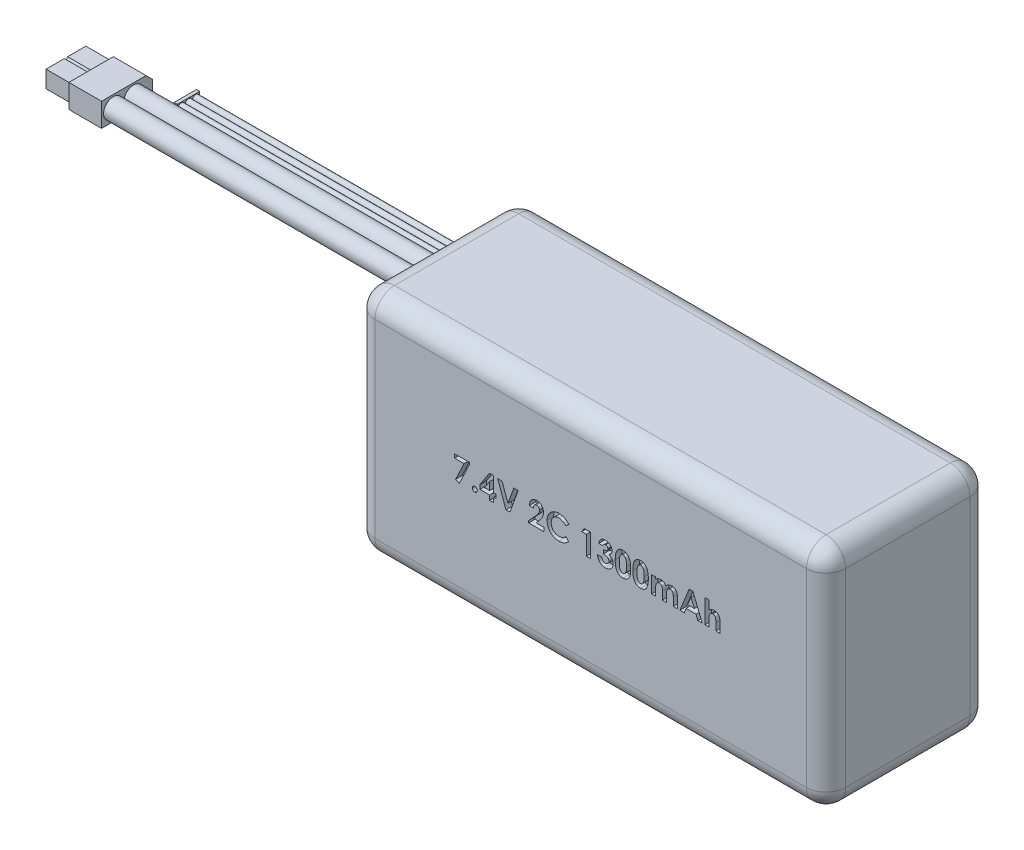
from build123d import *

# Parameters (mm, degrees)
SKETCH_1_W           = 72
SKETCH_1_H           = 35
EXTRUDE_1_DEPTH      = 25
FILLET_2_R           = 3
CUT_EXTRUDE_2_DEPTH  = 1
EXTRUDE_2_DEPTH      = 50
EXTRUDE_2_DEPTH_BACK = 5
SKETCH_3_R           = 1.5
SKETCH_5_W           = 7.8
SKETCH_5_H           = 3.6
EXTRUDE_3_DEPTH      = 5
CHAMFER_1_SIZE       = 1
EXTRUDE_4_DEPTH      = 4
SKETCH_6_R           = 1
CUT_EXTRUDE_3_DEPTH  = 4
EXTRUDE_5_DEPTH      = 40
EXTRUDE_5_DEPTH_BACK = 4
SKETCH_7_R           = 0.5
SKETCH_8_W           = 3.4
SKETCH_8_H           = 1.2
EXTRUDE_6_DEPTH      = 0.5


with BuildPart() as part:
    # ｽｹｯﾁ1 → ﾎﾞｽ - 押し出し1 (new body)
    with BuildSketch(Plane.XY):
        Rectangle(SKETCH_1_W, SKETCH_1_H)
    extrude(amount=EXTRUDE_1_DEPTH)

    # ﾌｨﾚｯﾄ2
    fillet_2_edges = [part.edges().sort_by_distance(p)[0] for p in [
        (36, 0, 25),
        (0, 17.5, 25),
        (-36, 0, 25),
        (0, 17.5, 0),
        (36, 0, 0),
        (0, -17.5, 0),
        (-36, 0, 0),
        (0, -17.5, 25),
        (-36, 17.5, 12.5),
        (36, 17.5, 12.5),
        (36, -17.5, 12.5),
        (-36, -17.5, 12.5),
    ]]
    fillet(fillet_2_edges, radius=FILLET_2_R)

    # ｽｹｯﾁ2 → ｶｯﾄ - 押し出し2 (cut)
    # profile 1 of 13: a face of its own
    with BuildSketch(Plane.XY.offset(25)):
        Polygon((-20.796502723, 2.806037284), (-18.552912979, 2.806037284), (-18.552912979, 2.48001565), (-20.096783171, -0.783706305), (-20.653473877, -0.503257587), (-19.363409774, 2.222703951), (-20.796502723, 2.222703951), align=None)
    # profile 2 of 13: a face of its own
    with BuildSketch(Plane.XY.offset(25)):
        with BuildLine():
            add(Edge.make_bspline(
                [(-17.722784774, 0.023986002), (-17.697424878, 0.02259558), (-17.647495622, 0.019858079), (-17.575354655, -0.000571605), (-17.510247017, -0.037276444), (-17.45203209, -0.085151545), (-17.402807013, -0.142751683), (-17.367228241, -0.208437598), (-17.345072447, -0.280300596), (-17.342626431, -0.330386935), (-17.341374518, -0.35602201)],
                knots=[0, 0, 0, 0, 1.016957001, 2.002212695, 2.9757545, 3.99499976, 5.013036768, 5.994806404, 6.97370641, 8, 8, 8, 8], degree=3))
            add(Edge.make_bspline(
                [(-17.341374518, -0.35602201), (-17.34261823, -0.381661203), (-17.345048222, -0.431755586), (-17.367381557, -0.503758614), (-17.402753847, -0.569984407), (-17.452036039, -0.628201769), (-17.510005929, -0.676979121), (-17.575504349, -0.713345487), (-17.647358195, -0.734934096), (-17.697400689, -0.737521864), (-17.722784774, -0.73883451)],
                knots=[0, 0, 0, 0, 1.023218912, 1.999186227, 2.986238111, 4.008388923, 5.030539734, 6.0011649, 6.986089706, 8, 8, 8, 8], degree=3))
            add(Edge.make_bspline(
                [(-17.722784774, -0.73883451), (-17.748174874, -0.737532538), (-17.798229225, -0.734965813), (-17.870194763, -0.713163516), (-17.936176743, -0.677221916), (-17.994161198, -0.628142602), (-18.043663561, -0.57019056), (-18.078030185, -0.50354966), (-18.100571548, -0.431782732), (-18.10296832, -0.381670393), (-18.10419503, -0.35602201)],
                knots=[0, 0, 0, 0, 1.013427518, 1.99788335, 2.976245624, 3.997909735, 5.019573847, 6.001765691, 6.977268297, 8, 8, 8, 8], degree=3))
            add(Edge.make_bspline(
                [(-18.10419503, -0.35602201), (-18.102960227, -0.330377585), (-18.100547643, -0.280272977), (-18.078183064, -0.208648959), (-18.043608483, -0.14254441), (-17.994165326, -0.085210835), (-17.935934413, -0.037035544), (-17.870345297, -0.000751083), (-17.798091867, 0.01989003), (-17.748150714, 0.022606342), (-17.722784774, 0.023986002)],
                knots=[0, 0, 0, 0, 1.025808215, 2.00424526, 2.981110158, 3.998665696, 5.017428914, 5.998734231, 6.983523959, 8, 8, 8, 8], degree=3))
        make_face()
    # profile 3 of 13: a face of its own
    with BuildSketch(Plane.XY.offset(25)):
        Polygon((-15.483401761, 2.895780874), (-14.828554005, 2.895780874), (-14.828554005, 0.607319336), (-14.514451441, 0.607319336), (-14.514451441, 0.023986002), (-14.828554005, 0.023986002), (-14.828554005, -0.693962716), (-15.456759133, -0.693962716), (-15.456759133, 0.023986002), (-16.937528364, 0.023986002), (-16.937528364, 0.65990347), align=None)
        Polygon((-15.456759133, 0.607319336), (-15.456759133, 1.798525265), (-16.231498716, 0.607319336), align=None, mode=Mode.SUBTRACT)
    # profile 4 of 13: a face of its own
    with BuildSketch(Plane.XY.offset(25)):
        Polygon((-14.222784774, 2.806037284), (-13.551811216, 2.806037284), (-12.652271954, 0.3198594), (-11.750629325, 2.806037284), (-11.081759133, 2.806037284), (-12.350789582, -0.693962716), (-12.955857691, -0.693962716), align=None)
    # profile 5 of 13: a face of its own
    with BuildSketch(Plane.XY.offset(25)):
        with BuildLine():
            Line((-8.770861697, 1.639370618), (-9.399066825, 1.639370618))
            add(Edge.make_bspline(
                [(-9.399066825, 1.639370618), (-9.396353704, 1.686891012), (-9.391052427, 1.77974301), (-9.369965288, 1.91461351), (-9.341709246, 2.042051301), (-9.303997806, 2.161610593), (-9.256610915, 2.273247941), (-9.200767958, 2.377343922), (-9.135042276, 2.473350471), (-9.060832727, 2.560804588), (-8.979399185, 2.639260483), (-8.89243229, 2.708824409), (-8.798601767, 2.76622681), (-8.699621976, 2.813463671), (-8.59550977, 2.851203729), (-8.485280086, 2.876436011), (-8.369887351, 2.89352356), (-8.29089168, 2.895018789), (-8.250629325, 2.895780874)],
                knots=[0, 0, 0, 0, 1.199038563, 2.342849363, 3.436047546, 4.486744587, 5.497670872, 6.488682221, 7.459191391, 8.424610317, 9.374430501, 10.305433194, 11.225809216, 12.140057399, 13.06607119, 14.010487599, 14.985989317, 16, 16, 16, 16], degree=3))
            add(Edge.make_bspline(
                [(-8.250629325, 2.895780874), (-8.201207856, 2.894238794), (-8.104725565, 2.891228292), (-7.964529145, 2.865547713), (-7.833601016, 2.822592975), (-7.712036353, 2.762573878), (-7.600870055, 2.686325907), (-7.500120559, 2.595412681), (-7.412834688, 2.487926791), (-7.338459025, 2.368340552), (-7.276661738, 2.241715555), (-7.233356774, 2.110780056), (-7.204892887, 1.979008555), (-7.201857037, 1.890280295), (-7.200348877, 1.846201547)],
                knots=[0, 0, 0, 0, 1.075374347, 2.099382735, 3.09057751, 4.06680945, 5.040638231, 6.016817125, 7.011024321, 8.044445721, 9.0776792, 10.070479129, 11.0414456, 12, 12, 12, 12], degree=3))
            add(Edge.make_bspline(
                [(-7.200348877, 1.846201547), (-7.200936075, 1.819539605), (-7.202117959, 1.765875702), (-7.21033576, 1.684669045), (-7.222664085, 1.601950571), (-7.241252195, 1.517791203), (-7.264433091, 1.43216735), (-7.292554869, 1.344822768), (-7.326269841, 1.256252671), (-7.365015373, 1.165460216), (-7.41123889, 1.072150636), (-7.465059751, 0.974925183), (-7.527906482, 0.873870106), (-7.599019976, 0.768414813), (-7.678745612, 0.658725624), (-7.767472586, 0.545132958), (-7.864178971, 0.427236549), (-7.932814213, 0.348429416), (-7.968077242, 0.307940329)],
                knots=[0, 0, 0, 0, 0.728284026, 1.46585585, 2.227944881, 3.01186502, 3.81876927, 4.650621989, 5.517437689, 6.406905708, 7.346299482, 8.360816762, 9.441613733, 10.596154504, 11.834900912, 13.145207542, 14.533280747, 16, 16, 16, 16], degree=3))
            Line((-7.968077242, 0.307940329), (-8.333361697, -0.110629382))
            Line((-8.333361697, -0.110629382), (-7.155477082, -0.110629382))
            Line((-7.155477082, -0.110629382), (-7.155477082, -0.693962716))
            Line((-7.155477082, -0.693962716), (-9.488810415, -0.693962716))
            Line((-9.488810415, -0.693962716), (-9.488810415, -0.375653421))
            Line((-9.488810415, -0.375653421), (-8.452552402, 0.727211163))
            add(Edge.make_bspline(
                [(-8.452552402, 0.727211163), (-8.42255007, 0.759382065), (-8.364444449, 0.821687562), (-8.281766139, 0.913189814), (-8.206949572, 1.000023267), (-8.14154613, 1.083112521), (-8.082123525, 1.159762501), (-8.031331406, 1.232283531), (-7.988705065, 1.300019996), (-7.942428126, 1.381698343), (-7.898480246, 1.479114306), (-7.858155406, 1.59134149), (-7.833574626, 1.698604831), (-7.830181701, 1.76849993), (-7.828554005, 1.802030874)],
                knots=[0, 0, 0, 0, 1.246127091, 2.413378631, 3.493388633, 4.492180848, 5.408488754, 6.240484944, 6.999099869, 7.674939598, 8.898438119, 10.020720584, 11.050475521, 12, 12, 12, 12], degree=3))
            add(Edge.make_bspline(
                [(-7.828554005, 1.802030874), (-7.829770994, 1.834469476), (-7.832129105, 1.897324467), (-7.858042839, 1.986735357), (-7.898189293, 2.067687791), (-7.954761317, 2.137762818), (-8.023287756, 2.195348115), (-8.102476494, 2.238178441), (-8.191681909, 2.262891343), (-8.254216604, 2.265984515), (-8.286386537, 2.267575746)],
                knots=[0, 0, 0, 0, 1.062038974, 2.057870785, 3.028805853, 4.01125022, 4.991535629, 5.949134679, 6.94496649, 8, 8, 8, 8], degree=3))
            add(Edge.make_bspline(
                [(-8.286386537, 2.267575746), (-8.303005934, 2.266987926), (-8.335723886, 2.265830708), (-8.383816718, 2.258127423), (-8.429580502, 2.244551188), (-8.473524616, 2.226360943), (-8.515180077, 2.202249642), (-8.554441815, 2.172528623), (-8.591723502, 2.137953164), (-8.626854151, 2.098631377), (-8.658827628, 2.054748251), (-8.687226353, 2.00670457), (-8.710707371, 1.954530154), (-8.731380913, 1.898913787), (-8.747325337, 1.839258102), (-8.758934856, 1.775920132), (-8.767760798, 1.709002921), (-8.769809261, 1.66300363), (-8.770861697, 1.639370618)],
                knots=[0, 0, 0, 0, 0.903469896, 1.778625579, 2.63899355, 3.493148037, 4.358286772, 5.247621495, 6.164656832, 7.118446693, 8.109501108, 9.111810964, 10.146451449, 11.215617525, 12.33435995, 13.498009769, 14.714554818, 16, 16, 16, 16], degree=3))
        make_face()
    # profile 6 of 13: a face of its own
    with BuildSketch(Plane.XY.offset(25)):
        with BuildLine():
            Line((-3.341374518, 2.19886581), (-3.802011537, 1.758561323))
            add(Edge.make_bspline(
                [(-3.802011537, 1.758561323), (-3.841086522, 1.798964923), (-3.917412208, 1.877885811), (-4.040401613, 1.982370112), (-4.168306116, 2.069443639), (-4.298637591, 2.14277641), (-4.433740322, 2.198257877), (-4.572052154, 2.238688157), (-4.714456249, 2.26333697), (-4.810829864, 2.266157231), (-4.859303204, 2.267575746)],
                knots=[0, 0, 0, 0, 1.115251505, 2.178435587, 3.19620269, 4.182487026, 5.141301733, 6.088180966, 7.038406374, 8, 8, 8, 8], degree=3))
            add(Edge.make_bspline(
                [(-4.859303204, 2.267575746), (-4.899784333, 2.266455069), (-4.979669381, 2.264243537), (-5.096961566, 2.248030827), (-5.209157603, 2.220460408), (-5.316641556, 2.182463263), (-5.41909715, 2.133296975), (-5.516739195, 2.072999596), (-5.609326958, 2.002115697), (-5.69563741, 1.921012036), (-5.774591179, 1.832400192), (-5.84435186, 1.737851565), (-5.902787621, 1.637582762), (-5.950744899, 1.532609231), (-5.988101766, 1.422445103), (-6.014779261, 1.307164544), (-6.030208812, 1.186630264), (-6.032511776, 1.104691959), (-6.03368221, 1.063048502)],
                knots=[0, 0, 0, 0, 1.035432265, 2.043311493, 3.022114605, 3.98653278, 4.95457646, 5.923598177, 6.917315552, 7.932509744, 8.948865224, 9.949768934, 10.933144597, 11.912367597, 12.897413939, 13.903909035, 14.934704909, 16, 16, 16, 16], degree=3))
            add(Edge.make_bspline(
                [(-6.03368221, 1.063048502), (-6.033344904, 1.033820211), (-6.032680068, 0.976210647), (-6.025402256, 0.890990113), (-6.013683264, 0.808306048), (-5.996722979, 0.728283696), (-5.975513975, 0.65085371), (-5.950630985, 0.575348104), (-5.919415639, 0.502810196), (-5.884766135, 0.432397506), (-5.84446916, 0.366031331), (-5.801021588, 0.302745676), (-5.75390979, 0.24285076), (-5.702828619, 0.186591435), (-5.647059172, 0.134846909), (-5.588042883, 0.086061162), (-5.524784229, 0.041455467), (-5.458597251, -8.9606e-05), (-5.388910179, -0.036180164), (-5.317613785, -0.068871237), (-5.24362707, -0.095421249), (-5.167850868, -0.11682298), (-5.090555976, -0.135021957), (-5.010986379, -0.146227626), (-4.929831845, -0.154713548), (-4.874985002, -0.155237504), (-4.847384133, -0.155501177)],
                knots=[0, 0, 0, 0, 1.103660481, 2.175337485, 3.227646561, 4.255952547, 5.262355991, 6.258840057, 7.255597736, 8.242457506, 9.22035537, 10.185017736, 11.140346927, 12.096287581, 13.051739095, 14.01125915, 14.986044842, 15.97314143, 16.960198552, 17.947847494, 18.933482797, 19.925264591, 20.920966487, 21.929612487, 22.958107872, 24, 24, 24, 24], degree=3))
            add(Edge.make_bspline(
                [(-4.847384133, -0.155501177), (-4.800568316, -0.154147015), (-4.70858741, -0.151486439), (-4.573592204, -0.130681112), (-4.444955222, -0.096457527), (-4.342174889, -0.056041461), (-4.261649212, -0.016130071), (-4.200346205, 0.020785999), (-4.136954118, 0.062080677), (-4.072525839, 0.109312468), (-4.006336678, 0.161914572), (-3.939555026, 0.221039073), (-3.870471261, 0.284739086), (-3.825215172, 0.330203037), (-3.802011537, 0.353513246)],
                knots=[0, 0, 0, 0, 1.404581149, 2.759636711, 4.088442092, 5.392261763, 6.066678138, 6.783632037, 7.538459478, 8.336747902, 9.180226004, 10.074962426, 11.012997595, 12, 12, 12, 12], degree=3))
            Line((-3.802011537, 0.353513246), (-3.355396954, -0.115537235))
            add(Edge.make_bspline(
                [(-3.355396954, -0.115537235), (-3.386791555, -0.145847737), (-3.448067103, -0.205007354), (-3.540499565, -0.289008491), (-3.632815698, -0.36449285), (-3.722785335, -0.434200184), (-3.811882274, -0.496099747), (-3.900097065, -0.550253361), (-3.986431079, -0.598030647), (-4.072677068, -0.638625867), (-4.159371701, -0.673095424), (-4.24857029, -0.702771451), (-4.340545524, -0.727876302), (-4.435859146, -0.748132619), (-4.533622127, -0.764375451), (-4.634749401, -0.775339269), (-4.738599769, -0.782709879), (-4.809043083, -0.783372189), (-4.844579646, -0.783706305)],
                knots=[0, 0, 0, 0, 1.244526981, 2.429050516, 3.560637417, 4.644440555, 5.67424972, 6.652764056, 7.595344123, 8.486817594, 9.369275933, 10.254498637, 11.166417451, 12.086725134, 13.032340136, 13.991389299, 14.986715468, 16, 16, 16, 16], degree=3))
            add(Edge.make_bspline(
                [(-4.844579646, -0.783706305), (-4.90985591, -0.782042283), (-5.037583414, -0.778786254), (-5.22476474, -0.754661285), (-5.402581976, -0.7142162), (-5.571467717, -0.657015694), (-5.731368261, -0.583944728), (-5.882242701, -0.494363155), (-6.023847862, -0.388508978), (-6.155039851, -0.267622913), (-6.273709249, -0.134114401), (-6.378599254, 0.009237113), (-6.46536427, 0.16313615), (-6.537407132, 0.325309131), (-6.593743703, 0.496496112), (-6.633395099, 0.676882267), (-6.657847825, 0.866293421), (-6.660522988, 0.995665605), (-6.661887338, 1.061646259)],
                knots=[0, 0, 0, 0, 1.078019885, 2.10938526, 3.111377082, 4.085535484, 5.04941344, 6.010039228, 6.978205633, 7.964457913, 8.951525778, 9.924444315, 10.892603023, 11.863865945, 12.85144698, 13.863884204, 14.910567087, 16, 16, 16, 16], degree=3))
            add(Edge.make_bspline(
                [(-6.661887338, 1.061646259), (-6.66131083, 1.104678278), (-6.660168331, 1.189957223), (-6.648160564, 1.315580017), (-6.631421038, 1.438039771), (-6.604865302, 1.556064947), (-6.572854982, 1.671245561), (-6.533045943, 1.782329735), (-6.485501766, 1.889636736), (-6.431754911, 1.993346202), (-6.370951632, 2.092778724), (-6.303027695, 2.187080022), (-6.229731726, 2.276978083), (-6.149302543, 2.361280243), (-6.062908887, 2.440726692), (-5.970160701, 2.514886893), (-5.871615818, 2.584824387), (-5.767007515, 2.648735658), (-5.658368052, 2.706546799), (-5.547067658, 2.757538694), (-5.433379786, 2.800156176), (-5.317785118, 2.835505805), (-5.199795268, 2.861891804), (-5.080252418, 2.881865154), (-4.958139402, 2.893030384), (-4.87615109, 2.894858203), (-4.834763941, 2.895780874)],
                knots=[0, 0, 0, 0, 1.071919942, 2.124283339, 3.142214191, 4.149696895, 5.136002878, 6.119640489, 7.086990633, 8.058538607, 9.028339693, 9.988281803, 10.952401235, 11.916291999, 12.888973767, 13.874849856, 14.873389453, 15.898127285, 16.927174885, 17.938320013, 18.946391617, 19.950418109, 20.947802303, 21.956882652, 22.968648068, 24, 24, 24, 24], degree=3))
            add(Edge.make_bspline(
                [(-4.834763941, 2.895780874), (-4.799456458, 2.895251976), (-4.729208594, 2.894199679), (-4.624597735, 2.885427639), (-4.520823504, 2.871651238), (-4.418257446, 2.850865583), (-4.316165903, 2.826190383), (-4.215890472, 2.793881614), (-4.115849255, 2.757867401), (-4.017611248, 2.714819764), (-3.921039326, 2.667829379), (-3.828395839, 2.614517081), (-3.738125311, 2.558163649), (-3.652228083, 2.495433841), (-3.569095114, 2.428602982), (-3.489161115, 2.357359269), (-3.413127552, 2.280514861), (-3.365413109, 2.22621975), (-3.341374518, 2.19886581)],
                knots=[0, 0, 0, 0, 0.996412454, 1.982464992, 2.961075852, 3.949442424, 4.934965278, 5.923860011, 6.921385422, 7.934793307, 8.949617135, 9.951082467, 10.950285876, 11.951772932, 12.951063433, 13.960125323, 14.972308753, 16, 16, 16, 16], degree=3))
        make_face()
    # profile 7 of 13: a face of its own
    with BuildSketch(Plane.XY.offset(25)):
        Polygon((-0.991915383, 2.806037284), (-0.020861697, 2.806037284), (-0.020861697, -0.693962716), (-0.649066825, -0.693962716), (-0.649066825, 2.222703951), (-1.367015543, 2.222703951), align=None)
    # profile 8 of 13: a face of its own
    with BuildSketch(Plane.XY.offset(25)):
        with BuildLine():
            Line((1.863753688, 1.953473182), (1.235548559, 1.953473182))
            add(Edge.make_bspline(
                [(1.235548559, 1.953473182), (1.239983926, 1.984874915), (1.24867917, 2.046435933), (1.269485725, 2.135560951), (1.294372609, 2.220102131), (1.325442613, 2.299791747), (1.361882673, 2.374771752), (1.403322234, 2.445299443), (1.450209274, 2.5110721), (1.486148687, 2.55069381), (1.504078207, 2.570460361)],
                knots=[0, 0, 0, 0, 1.111473889, 2.178970933, 3.205615836, 4.199322666, 5.174200091, 6.12565194, 7.064921805, 8, 8, 8, 8], degree=3))
            add(Edge.make_bspline(
                [(1.504078207, 2.570460361), (1.529939164, 2.596540893), (1.580908392, 2.647942881), (1.66608395, 2.713783149), (1.755363665, 2.770763424), (1.85053808, 2.815937798), (1.950126211, 2.85250122), (2.054920015, 2.877060954), (2.164491269, 2.893356554), (2.239259865, 2.894961727), (2.277415546, 2.895780874)],
                knots=[0, 0, 0, 0, 1.01925491, 2.00884431, 2.983262333, 3.955970413, 4.92937149, 5.924503185, 6.940838805, 8, 8, 8, 8], degree=3))
            add(Edge.make_bspline(
                [(2.277415546, 2.895780874), (2.311337911, 2.894980034), (2.378022443, 2.893405742), (2.476031927, 2.880768188), (2.569475767, 2.858603323), (2.659341694, 2.829623261), (2.744308071, 2.790191042), (2.826250188, 2.74441863), (2.902878581, 2.688276864), (2.974372546, 2.624842318), (3.040053388, 2.556231646), (3.096933284, 2.482892481), (3.145833952, 2.40678388), (3.186121635, 2.327273525), (3.217097387, 2.244226875), (3.238595479, 2.158123678), (3.252666501, 2.069153929), (3.254068343, 2.008682388), (3.254779329, 1.978012445)],
                knots=[0, 0, 0, 0, 1.091422571, 2.145516843, 3.172569842, 4.178562979, 5.178154469, 6.181868002, 7.194278174, 8.227918432, 9.254613415, 10.245994977, 11.209837596, 12.161663635, 13.10878368, 14.055455738, 15.013766427, 16, 16, 16, 16], degree=3))
            add(Edge.make_bspline(
                [(3.254779329, 1.978012445), (3.253320343, 1.940030273), (3.25044805, 1.865255055), (3.226878805, 1.755815968), (3.189986527, 1.65117267), (3.136692043, 1.552789279), (3.070060364, 1.460933539), (2.988305525, 1.378676464), (2.893756117, 1.304728373), (2.822776617, 1.26498866), (2.78642997, 1.244639047)],
                knots=[0, 0, 0, 0, 0.992805628, 1.954529043, 2.915727527, 3.886831945, 4.871318353, 5.87440735, 6.911542536, 8, 8, 8, 8], degree=3))
            add(Edge.make_bspline(
                [(2.78642997, 1.244639047), (2.811377751, 1.236448165), (2.860399022, 1.22035345), (2.930076865, 1.18865509), (2.996332531, 1.154014037), (3.058025123, 1.113770264), (3.115768247, 1.069551053), (3.169209894, 1.0209784), (3.218669366, 0.968158218), (3.263339258, 0.910800015), (3.302985532, 0.849821123), (3.338558022, 0.78663012), (3.367836165, 0.720268702), (3.392638397, 0.651494761), (3.411521404, 0.579690194), (3.424816729, 0.505133237), (3.432501752, 0.427993959), (3.43367385, 0.375732146), (3.434266508, 0.349306515)],
                knots=[0, 0, 0, 0, 1.059543567, 2.081955587, 3.086750234, 4.076226789, 5.052108497, 6.020845489, 6.989030705, 7.970690546, 8.952259656, 9.923888338, 10.895517021, 11.877585046, 12.873342345, 13.889638361, 14.932918083, 16, 16, 16, 16], degree=3))
            add(Edge.make_bspline(
                [(3.434266508, 0.349306515), (3.43306511, 0.310471568), (3.430696197, 0.233896961), (3.415635757, 0.121110401), (3.387595932, 0.013578436), (3.350707989, -0.08993625), (3.301503476, -0.188097321), (3.243598036, -0.28315744), (3.172420617, -0.371819948), (3.093319137, -0.456428851), (3.005472332, -0.533351478), (2.910232104, -0.600039934), (2.809692704, -0.657270494), (2.703218047, -0.703731894), (2.590845127, -0.739512485), (2.472824411, -0.765376346), (2.348660009, -0.781200284), (2.26390809, -0.782859124), (2.220624681, -0.783706305)],
                knots=[0, 0, 0, 0, 1.005138573, 1.981928558, 2.936866704, 3.876260664, 4.820238198, 5.773547, 6.751179199, 7.756627054, 8.768222608, 9.766606018, 10.760583154, 11.757261445, 12.767156078, 13.807575856, 14.880313354, 16, 16, 16, 16], degree=3))
            add(Edge.make_bspline(
                [(2.220624681, -0.783706305), (2.179679274, -0.782813096), (2.099615949, -0.781066543), (1.982506579, -0.765949242), (1.871205208, -0.741563808), (1.765427793, -0.707190517), (1.665583578, -0.662614233), (1.570767138, -0.609533881), (1.482870513, -0.544887909), (1.400914362, -0.471594559), (1.32671672, -0.389363582), (1.260401501, -0.300099817), (1.203430968, -0.203463831), (1.155571482, -0.099868494), (1.117197199, 0.010867933), (1.086927677, 0.12852026), (1.06578392, 0.253318345), (1.059344544, 0.339182082), (1.05606138, 0.382960361)],
                knots=[0, 0, 0, 0, 1.066544725, 2.085487077, 3.070979577, 4.031932826, 4.977951092, 5.916076795, 6.857635327, 7.814973522, 8.776389752, 9.738577119, 10.707772778, 11.69409279, 12.707140348, 13.757286496, 14.856535458, 16, 16, 16, 16], degree=3))
            Line((1.05606138, 0.382960361), (1.684266508, 0.382960361))
            add(Edge.make_bspline(
                [(1.684266508, 0.382960361), (1.688247378, 0.360948068), (1.696001167, 0.318073353), (1.711124457, 0.256000298), (1.730832214, 0.198703034), (1.753619284, 0.145672304), (1.778232751, 0.096211835), (1.807971704, 0.052148323), (1.84065703, 0.012285263), (1.887822194, -0.035104382), (1.955248044, -0.083795264), (2.046295279, -0.126109956), (2.147576706, -0.150911565), (2.218382525, -0.153937285), (2.254979649, -0.155501177)],
                knots=[0, 0, 0, 0, 0.928156231, 1.807827665, 2.648129825, 3.438902246, 4.202261636, 4.936546065, 5.639352463, 6.338805438, 7.70633318, 9.064371875, 10.482673459, 12, 12, 12, 12], degree=3))
            add(Edge.make_bspline(
                [(2.254979649, -0.155501177), (2.274399377, -0.155168161), (2.312438279, -0.154515857), (2.368311762, -0.147285941), (2.421539122, -0.135378263), (2.472219498, -0.119196171), (2.520675522, -0.098910906), (2.565981396, -0.072754271), (2.609060566, -0.042343449), (2.649444721, -0.008153612), (2.686760513, 0.029101072), (2.717809447, 0.070354305), (2.746185925, 0.112274962), (2.767173373, 0.157605642), (2.785562899, 0.203907069), (2.796818228, 0.252859841), (2.80531681, 0.303437058), (2.805810714, 0.338049886), (2.80606138, 0.355616611)],
                knots=[0, 0, 0, 0, 1.110435564, 2.175094844, 3.216326037, 4.226890168, 5.215276772, 6.21526065, 7.213097102, 8.228249917, 9.239874822, 10.221364777, 11.178138315, 12.128914389, 13.072518965, 14.022636769, 14.996447288, 16, 16, 16, 16], degree=3))
            add(Edge.make_bspline(
                [(2.80606138, 0.355616611), (2.805395908, 0.374828819), (2.804071106, 0.413075921), (2.793247334, 0.468889524), (2.776154311, 0.522577712), (2.752410015, 0.573902729), (2.720702153, 0.6226754), (2.683287229, 0.669874252), (2.637217567, 0.713042671), (2.586672978, 0.755713344), (2.528061111, 0.792909302), (2.464236446, 0.827235705), (2.393521572, 0.854548925), (2.317642703, 0.878944689), (2.235164518, 0.896762977), (2.146599177, 0.90970079), (2.052089548, 0.919330987), (1.986942833, 0.920712597), (1.953497277, 0.9214219)],
                knots=[0, 0, 0, 0, 0.809814727, 1.612155564, 2.388397, 3.182215007, 3.988903953, 4.837162975, 5.715530372, 6.646997145, 7.623086902, 8.637258368, 9.698941581, 10.815059213, 11.996518529, 13.252603015, 14.589518788, 16, 16, 16, 16], degree=3))
            Line((1.953497277, 0.9214219), (1.953497277, 1.504755233))
            add(Edge.make_bspline(
                [(1.953497277, 1.504755233), (1.995138983, 1.508301574), (2.073042367, 1.514936076), (2.181176442, 1.530451088), (2.272211394, 1.551189456), (2.34833525, 1.576209175), (2.411543622, 1.608341013), (2.466762107, 1.643813143), (2.514318878, 1.685008838), (2.554510729, 1.730699647), (2.58666296, 1.779767292), (2.609418435, 1.831449116), (2.624444962, 1.884146019), (2.625868725, 1.920189112), (2.6265742, 1.938048502)],
                knots=[0, 0, 0, 0, 1.70044513, 3.18119609, 4.440695891, 5.496282586, 6.431922213, 7.318171381, 8.16090191, 8.983045123, 9.787564368, 10.536848927, 11.275007137, 12, 12, 12, 12], degree=3))
            add(Edge.make_bspline(
                [(2.6265742, 1.938048502), (2.625357053, 1.960835145), (2.622981439, 2.005309846), (2.604531131, 2.068962514), (2.572503489, 2.125703591), (2.529560043, 2.175413678), (2.477231962, 2.216935269), (2.415894278, 2.247079236), (2.346878022, 2.264790163), (2.298321367, 2.266626189), (2.273208816, 2.267575746)],
                knots=[0, 0, 0, 0, 1.009664648, 1.970651636, 2.907870547, 3.878035693, 4.867062054, 5.849714035, 6.887914197, 8, 8, 8, 8], degree=3))
            add(Edge.make_bspline(
                [(2.273208816, 2.267575746), (2.250447111, 2.266455369), (2.205280919, 2.264232197), (2.139234426, 2.247639033), (2.076512263, 2.219706507), (2.018413227, 2.181189199), (1.965775991, 2.134931544), (1.922576006, 2.080148955), (1.886644308, 2.020123549), (1.871413807, 1.975777067), (1.863753688, 1.953473182)],
                knots=[0, 0, 0, 0, 0.98818071, 1.960853194, 2.938124878, 3.957524365, 4.978590984, 5.968022688, 6.978025184, 8, 8, 8, 8], degree=3))
        make_face()
    # profile 9 of 13: a face of its own
    with BuildSketch(Plane.XY.offset(25)):
        with BuildLine():
            add(Edge.make_bspline(
                [(4.926954809, 2.895780874), (4.957362545, 2.895329463), (5.017152277, 2.894441867), (5.105211299, 2.884828486), (5.190036483, 2.870305348), (5.271959677, 2.850050634), (5.35039119, 2.823244242), (5.425901861, 2.79115745), (5.497592895, 2.75210724), (5.566378583, 2.707998022), (5.632232428, 2.658060135), (5.693571679, 2.601128365), (5.75151652, 2.538512715), (5.80481266, 2.469266548), (5.854640357, 2.394019731), (5.900835887, 2.312760334), (5.943045611, 2.225090645), (5.981742599, 2.130852458), (6.016345567, 2.028633183), (6.045491605, 1.917260321), (6.07048921, 1.796708437), (6.091588952, 1.66667746), (6.107536946, 1.526994548), (6.118286216, 1.377752499), (6.125662873, 1.219239029), (6.126264904, 1.110500091), (6.1265742, 1.054635041)],
                knots=[0, 0, 0, 0, 0.879237366, 1.728815576, 2.559023295, 3.367336655, 4.166867292, 4.954216142, 5.737608147, 6.525189134, 7.316157332, 8.124696809, 8.942788509, 9.781158001, 10.649253743, 11.551476218, 12.482711956, 13.461909668, 14.496590415, 15.601789533, 16.789733467, 18.056700938, 19.410929216, 20.8549011, 22.384193279, 24, 24, 24, 24], degree=3))
            add(Edge.make_bspline(
                [(6.1265742, 1.054635041), (6.126239935, 0.998071056), (6.125590463, 0.888168249), (6.118592865, 0.728204935), (6.106542671, 0.577879298), (6.09101151, 0.437206892), (6.069738069, 0.306262004), (6.044823912, 0.184705573), (6.015217813, 0.072581662), (5.979475033, -0.029857091), (5.941012279, -0.124260781), (5.898687094, -0.211759534), (5.853237199, -0.292590347), (5.805705079, -0.367972661), (5.753484848, -0.435684244), (5.699118211, -0.498027645), (5.640237948, -0.552628122), (5.579323147, -0.60229954), (5.51414225, -0.645225614), (5.445367453, -0.68276805), (5.371772619, -0.713219425), (5.294699257, -0.739704404), (5.212833636, -0.758717761), (5.127476589, -0.773804235), (5.037664454, -0.782141946), (4.976516735, -0.783176294), (4.945183976, -0.783706305)],
                knots=[0, 0, 0, 0, 1.643780988, 3.193836972, 4.651895693, 6.025988579, 7.305620092, 8.505800249, 9.631074763, 10.672816429, 11.65661981, 12.592235626, 13.49536222, 14.350718032, 15.179365177, 15.97804903, 16.751647189, 17.51006938, 18.259804725, 19.016521909, 19.783502495, 20.571750527, 21.382245291, 22.22305063, 23.089471752, 24, 24, 24, 24], degree=3))
            add(Edge.make_bspline(
                [(4.945183976, -0.783706305), (4.913852063, -0.783166071), (4.852473306, -0.782107759), (4.76241831, -0.77386623), (4.676608914, -0.758656645), (4.594095605, -0.739558433), (4.515452661, -0.713278025), (4.440302993, -0.681915567), (4.369224436, -0.644607377), (4.302020185, -0.60158129), (4.238919694, -0.552242211), (4.178942383, -0.497117878), (4.122220924, -0.436348015), (4.069618191, -0.36925195), (4.020272705, -0.296725277), (3.974699059, -0.217939775), (3.932924644, -0.133010154), (3.893642747, -0.041818032), (3.859511751, 0.057599855), (3.829136749, 0.166131294), (3.804254346, 0.284680984), (3.784242253, 0.413210842), (3.768264609, 0.551448569), (3.756379079, 0.699460891), (3.749342612, 0.857316746), (3.748699952, 0.965818939), (3.748369072, 1.021682316)],
                knots=[0, 0, 0, 0, 0.917216111, 1.796812873, 2.643793957, 3.46689424, 4.273913431, 5.068098542, 5.848489301, 6.620921603, 7.401012384, 8.190319798, 9.003608147, 9.831726257, 10.68377682, 11.569763213, 12.493818149, 13.453288342, 14.474581811, 15.568529029, 16.750744269, 18.018426408, 19.375425659, 20.823733699, 22.36466933, 24, 24, 24, 24], degree=3))
            add(Edge.make_bspline(
                [(3.748369072, 1.021682316), (3.74896843, 1.099300082), (3.750124899, 1.24906456), (3.764780519, 1.465430686), (3.786291253, 1.665423691), (3.817885425, 1.848709033), (3.856951182, 2.015965549), (3.906976918, 2.166091441), (3.963927579, 2.301164036), (4.012456859, 2.381181855), (4.035829008, 2.419719175)],
                knots=[0, 0, 0, 0, 1.288568992, 2.486310467, 3.599230591, 4.627010532, 5.572937695, 6.447898582, 7.252493626, 8, 8, 8, 8], degree=3))
            add(Edge.make_bspline(
                [(4.035829008, 2.419719175), (4.06300503, 2.457578227), (4.116139508, 2.531600133), (4.209046628, 2.628777058), (4.308863232, 2.711887524), (4.417639496, 2.779050665), (4.533655078, 2.832015523), (4.657906032, 2.869424006), (4.789933518, 2.891219931), (4.880598996, 2.894237857), (4.926954809, 2.895780874)],
                knots=[0, 0, 0, 0, 1.058512271, 2.069600068, 3.047294572, 4.004278952, 4.967380941, 5.939006123, 6.946246673, 8, 8, 8, 8], degree=3))
        make_face()
        with BuildLine():
            add(Edge.make_bspline(
                [(4.942379489, 2.267575746), (4.914890644, 2.266272829), (4.860997915, 2.263718421), (4.782796999, 2.2420351), (4.709058417, 2.20854404), (4.652967447, 2.168242787), (4.610983914, 2.129609203), (4.581649719, 2.094647065), (4.553361511, 2.05563184), (4.528375941, 2.010802969), (4.50478304, 1.961771208), (4.481725665, 1.908313982), (4.462824672, 1.849118266), (4.444254948, 1.78519217), (4.427986136, 1.714768307), (4.414356439, 1.63727104), (4.402179503, 1.552196398), (4.393685944, 1.459488657), (4.385767399, 1.35924481), (4.38009101, 1.251241555), (4.377717855, 1.135508028), (4.376963501, 1.055804065), (4.3765742, 1.014671099)],
                knots=[0, 0, 0, 0, 1.076674018, 2.110852608, 3.161083442, 4.239746716, 4.804137807, 5.395870207, 6.026861976, 6.692161227, 7.405688833, 8.16177676, 8.973626916, 9.841385931, 10.773283133, 11.807421078, 12.927755683, 14.143907515, 15.458935494, 16.872852025, 18.386167141, 20, 20, 20, 20], degree=3))
            add(Edge.make_bspline(
                [(4.3765742, 1.014671099), (4.377214942, 0.961381352), (4.378443612, 0.859194311), (4.384878811, 0.712245788), (4.397777634, 0.578510799), (4.413821165, 0.457082974), (4.436354959, 0.348749803), (4.462281548, 0.252486355), (4.494298581, 0.169519754), (4.531300431, 0.098650118), (4.572281647, 0.038361466), (4.616768559, -0.01288416), (4.663246549, -0.057260455), (4.713166344, -0.093306772), (4.766408852, -0.120931008), (4.822529595, -0.140800779), (4.881564237, -0.152963894), (4.921990552, -0.154650527), (4.942379489, -0.155501177)],
                knots=[0, 0, 0, 0, 1.771748488, 3.397459088, 4.888034009, 6.237357457, 7.467047327, 8.564189669, 9.548206622, 10.417051504, 11.216568818, 11.965764335, 12.669334354, 13.348544111, 14.005342236, 14.656555988, 15.322436492, 16, 16, 16, 16], degree=3))
            add(Edge.make_bspline(
                [(4.942379489, -0.155501177), (4.962068742, -0.154919099), (5.000617852, -0.153779462), (5.056831088, -0.142081247), (5.109990317, -0.123062489), (5.159935037, -0.09615912), (5.206843892, -0.061947371), (5.250487621, -0.0202769), (5.290537072, 0.02926765), (5.313870063, 0.066037034), (5.325893111, 0.084983599)],
                knots=[0, 0, 0, 0, 0.992283464, 1.942767638, 2.88273346, 3.832339453, 4.79467288, 5.803907806, 6.868395428, 8, 8, 8, 8], degree=3))
            add(Edge.make_bspline(
                [(5.325893111, 0.084983599), (5.340048224, 0.110873474), (5.369730348, 0.165162442), (5.404078553, 0.256773052), (5.432990958, 0.360094679), (5.457875443, 0.475448869), (5.474894912, 0.603290595), (5.489552058, 0.742809199), (5.496621564, 0.894707242), (5.497771457, 0.999942755), (5.498369072, 1.054635041)],
                knots=[0, 0, 0, 0, 0.710965849, 1.490837728, 2.352621235, 3.297892224, 4.334225155, 5.461620853, 6.680770821, 8, 8, 8, 8], degree=3))
            add(Edge.make_bspline(
                [(5.498369072, 1.054635041), (5.498138226, 1.109802082), (5.497693888, 1.21598922), (5.489541561, 1.368433347), (5.478188823, 1.507665757), (5.461583044, 1.6333756), (5.440216692, 1.745868046), (5.413882582, 1.845135739), (5.382836625, 1.931374317), (5.34601982, 2.004497789), (5.305242921, 2.06664271), (5.261956998, 2.119958231), (5.215979021, 2.165477679), (5.167385879, 2.203372349), (5.115052867, 2.232326719), (5.059979615, 2.2527709), (5.002053217, 2.265138944), (4.962539213, 2.266752515), (4.942379489, 2.267575746)],
                knots=[0, 0, 0, 0, 1.793836731, 3.452829483, 4.963243077, 6.335886805, 7.574563692, 8.684454726, 9.672768357, 10.54971625, 11.340229787, 12.085688095, 12.778991901, 13.440269426, 14.083255152, 14.715733572, 15.344777694, 16, 16, 16, 16], degree=3))
        make_face(mode=Mode.SUBTRACT)
    # profile 10 of 13: a face of its own
    with BuildSketch(Plane.XY.offset(25)):
        with BuildLine():
            add(Edge.make_bspline(
                [(7.619262502, 2.895780874), (7.649670237, 2.895329463), (7.70945997, 2.894441867), (7.797518991, 2.884828486), (7.882344176, 2.870305348), (7.96426737, 2.850050634), (8.042698882, 2.823244242), (8.118209553, 2.79115745), (8.189900588, 2.75210724), (8.258686276, 2.707998022), (8.32454012, 2.658060135), (8.385879371, 2.601128365), (8.443824212, 2.538512715), (8.497120352, 2.469266548), (8.546948049, 2.394019731), (8.593143579, 2.312760334), (8.635353303, 2.225090645), (8.674050291, 2.130852458), (8.70865326, 2.028633183), (8.737799297, 1.917260321), (8.762796902, 1.796708437), (8.783896644, 1.66667746), (8.799844638, 1.526994548), (8.810593908, 1.377752499), (8.817970565, 1.219239029), (8.818572597, 1.110500091), (8.818881893, 1.054635041)],
                knots=[0, 0, 0, 0, 0.879237366, 1.728815576, 2.559023295, 3.367336655, 4.166867292, 4.954216142, 5.737608147, 6.525189134, 7.316157332, 8.124696809, 8.942788509, 9.781158001, 10.649253743, 11.551476218, 12.482711956, 13.461909668, 14.496590415, 15.601789533, 16.789733467, 18.056700938, 19.410929216, 20.8549011, 22.384193279, 24, 24, 24, 24], degree=3))
            add(Edge.make_bspline(
                [(8.818881893, 1.054635041), (8.818547627, 0.998071056), (8.817898156, 0.888168249), (8.810900558, 0.728204935), (8.798850363, 0.577879298), (8.783319203, 0.437206892), (8.762045761, 0.306262004), (8.737131604, 0.184705573), (8.707525505, 0.072581662), (8.671782726, -0.029857091), (8.633319971, -0.124260781), (8.590994786, -0.211759534), (8.545544892, -0.292590347), (8.498012771, -0.367972661), (8.44579254, -0.435684244), (8.391425903, -0.498027645), (8.332545641, -0.552628122), (8.271630839, -0.60229954), (8.206449943, -0.645225614), (8.137675145, -0.68276805), (8.064080311, -0.713219425), (7.987006949, -0.739704404), (7.905141328, -0.758717761), (7.819784282, -0.773804235), (7.729972146, -0.782141946), (7.668824427, -0.783176294), (7.637491668, -0.783706305)],
                knots=[0, 0, 0, 0, 1.643780988, 3.193836972, 4.651895693, 6.025988579, 7.305620092, 8.505800249, 9.631074763, 10.672816429, 11.65661981, 12.592235626, 13.49536222, 14.350718032, 15.179365177, 15.97804903, 16.751647189, 17.51006938, 18.259804725, 19.016521909, 19.783502495, 20.571750527, 21.382245291, 22.22305063, 23.089471752, 24, 24, 24, 24], degree=3))
            add(Edge.make_bspline(
                [(7.637491668, -0.783706305), (7.606159755, -0.783166071), (7.544780999, -0.782107759), (7.454726002, -0.77386623), (7.368916606, -0.758656645), (7.286403297, -0.739558433), (7.207760353, -0.713278025), (7.132610685, -0.681915567), (7.061532128, -0.644607377), (6.994327877, -0.60158129), (6.931227387, -0.552242211), (6.871250075, -0.497117878), (6.814528616, -0.436348015), (6.761925884, -0.36925195), (6.712580397, -0.296725277), (6.667006752, -0.217939775), (6.625232336, -0.133010154), (6.585950439, -0.041818032), (6.551819443, 0.057599855), (6.521444441, 0.166131294), (6.496562038, 0.284680984), (6.476549945, 0.413210842), (6.460572302, 0.551448569), (6.448686771, 0.699460891), (6.441650305, 0.857316746), (6.441007644, 0.965818939), (6.440676764, 1.021682316)],
                knots=[0, 0, 0, 0, 0.917216111, 1.796812873, 2.643793957, 3.46689424, 4.273913431, 5.068098542, 5.848489301, 6.620921603, 7.401012384, 8.190319798, 9.003608147, 9.831726257, 10.68377682, 11.569763213, 12.493818149, 13.453288342, 14.474581811, 15.568529029, 16.750744269, 18.018426408, 19.375425659, 20.823733699, 22.36466933, 24, 24, 24, 24], degree=3))
            add(Edge.make_bspline(
                [(6.440676764, 1.021682316), (6.441276122, 1.099300082), (6.442432591, 1.24906456), (6.457088211, 1.465430686), (6.478598945, 1.665423691), (6.510193117, 1.848709033), (6.549258874, 2.015965549), (6.59928461, 2.166091441), (6.656235271, 2.301164036), (6.704764551, 2.381181855), (6.7281367, 2.419719175)],
                knots=[0, 0, 0, 0, 1.288568992, 2.486310467, 3.599230591, 4.627010532, 5.572937695, 6.447898582, 7.252493626, 8, 8, 8, 8], degree=3))
            add(Edge.make_bspline(
                [(6.7281367, 2.419719175), (6.755312722, 2.457578227), (6.8084472, 2.531600133), (6.90135432, 2.628777058), (7.001170924, 2.711887524), (7.109947188, 2.779050665), (7.22596277, 2.832015523), (7.350213724, 2.869424006), (7.48224121, 2.891219931), (7.572906688, 2.894237857), (7.619262502, 2.895780874)],
                knots=[0, 0, 0, 0, 1.058512271, 2.069600068, 3.047294572, 4.004278952, 4.967380941, 5.939006123, 6.946246673, 8, 8, 8, 8], degree=3))
        make_face()
        with BuildLine():
            add(Edge.make_bspline(
                [(7.634687181, 2.267575746), (7.607198336, 2.266272829), (7.553305608, 2.263718421), (7.475104691, 2.2420351), (7.401366109, 2.20854404), (7.34527514, 2.168242787), (7.303291607, 2.129609203), (7.273957411, 2.094647065), (7.245669203, 2.05563184), (7.220683633, 2.010802969), (7.197090733, 1.961771208), (7.174033358, 1.908313982), (7.155132365, 1.849118266), (7.13656264, 1.78519217), (7.120293829, 1.714768307), (7.106664131, 1.63727104), (7.094487195, 1.552196398), (7.085993636, 1.459488657), (7.078075091, 1.35924481), (7.072398703, 1.251241555), (7.070025547, 1.135508028), (7.069271193, 1.055804065), (7.068881893, 1.014671099)],
                knots=[0, 0, 0, 0, 1.076674018, 2.110852608, 3.161083442, 4.239746716, 4.804137807, 5.395870207, 6.026861976, 6.692161227, 7.405688833, 8.16177676, 8.973626916, 9.841385931, 10.773283133, 11.807421078, 12.927755683, 14.143907515, 15.458935494, 16.872852025, 18.386167141, 20, 20, 20, 20], degree=3))
            add(Edge.make_bspline(
                [(7.068881893, 1.014671099), (7.069522634, 0.961381352), (7.070751304, 0.859194311), (7.077186504, 0.712245788), (7.090085326, 0.578510799), (7.106128857, 0.457082974), (7.128662652, 0.348749803), (7.154589241, 0.252486355), (7.186606273, 0.169519754), (7.223608123, 0.098650118), (7.264589339, 0.038361466), (7.309076252, -0.01288416), (7.355554241, -0.057260455), (7.405474037, -0.093306772), (7.458716545, -0.120931008), (7.514837288, -0.140800779), (7.57387193, -0.152963894), (7.614298244, -0.154650527), (7.634687181, -0.155501177)],
                knots=[0, 0, 0, 0, 1.771748488, 3.397459088, 4.888034009, 6.237357457, 7.467047327, 8.564189669, 9.548206622, 10.417051504, 11.216568818, 11.965764335, 12.669334354, 13.348544111, 14.005342236, 14.656555988, 15.322436492, 16, 16, 16, 16], degree=3))
            add(Edge.make_bspline(
                [(7.634687181, -0.155501177), (7.654376434, -0.154919099), (7.692925544, -0.153779462), (7.74913878, -0.142081247), (7.80229801, -0.123062489), (7.85224273, -0.09615912), (7.899151585, -0.061947371), (7.942795314, -0.0202769), (7.982844764, 0.02926765), (8.006177756, 0.066037034), (8.018200803, 0.084983599)],
                knots=[0, 0, 0, 0, 0.992283464, 1.942767638, 2.88273346, 3.832339453, 4.79467288, 5.803907806, 6.868395428, 8, 8, 8, 8], degree=3))
            add(Edge.make_bspline(
                [(8.018200803, 0.084983599), (8.032355916, 0.110873474), (8.06203804, 0.165162442), (8.096386246, 0.256773052), (8.125298651, 0.360094679), (8.150183135, 0.475448869), (8.167202604, 0.603290595), (8.18185975, 0.742809199), (8.188929256, 0.894707242), (8.19007915, 0.999942755), (8.190676764, 1.054635041)],
                knots=[0, 0, 0, 0, 0.710965849, 1.490837728, 2.352621235, 3.297892224, 4.334225155, 5.461620853, 6.680770821, 8, 8, 8, 8], degree=3))
            add(Edge.make_bspline(
                [(8.190676764, 1.054635041), (8.190445919, 1.109802082), (8.19000158, 1.21598922), (8.181849253, 1.368433347), (8.170496515, 1.507665757), (8.153890736, 1.6333756), (8.132524384, 1.745868046), (8.106190274, 1.845135739), (8.075144317, 1.931374317), (8.038327512, 2.004497789), (7.997550614, 2.06664271), (7.954264691, 2.119958231), (7.908286713, 2.165477679), (7.859693571, 2.203372349), (7.80736056, 2.232326719), (7.752287307, 2.2527709), (7.694360909, 2.265138944), (7.654846905, 2.266752515), (7.634687181, 2.267575746)],
                knots=[0, 0, 0, 0, 1.793836731, 3.452829483, 4.963243077, 6.335886805, 7.574563692, 8.684454726, 9.672768357, 10.54971625, 11.340229787, 12.085688095, 12.778991901, 13.440269426, 14.083255152, 14.715733572, 15.344777694, 16, 16, 16, 16], degree=3))
        make_face(mode=Mode.SUBTRACT)
    # profile 11 of 13: a face of its own
    with BuildSketch(Plane.XY.offset(25)):
        with BuildLine():
            Line((9.312471636, 1.863729592), (9.940676764, 1.863729592))
            Line((9.940676764, 1.863729592), (9.940676764, 1.55804049))
            add(Edge.make_bspline(
                [(9.940676764, 1.55804049), (9.968619009, 1.586242245), (10.023634993, 1.641769182), (10.11480724, 1.713154052), (10.209909126, 1.774196935), (10.310093134, 1.823614991), (10.415114219, 1.861349246), (10.524474635, 1.889000351), (10.638736104, 1.905313637), (10.716532721, 1.907493322), (10.756081412, 1.908601387)],
                knots=[0, 0, 0, 0, 1.041528618, 2.050684245, 3.032913108, 4.004406485, 4.976926473, 5.95771665, 6.961784757, 8, 8, 8, 8], degree=3))
            add(Edge.make_bspline(
                [(10.756081412, 1.908601387), (10.795682321, 1.907355762), (10.87363543, 1.90490379), (10.987368474, 1.882465944), (11.095112362, 1.846012027), (11.195681657, 1.794051447), (11.289803216, 1.729882832), (11.373307392, 1.650191029), (11.448471185, 1.558148396), (11.488536381, 1.488563175), (11.50908622, 1.45287222)],
                knots=[0, 0, 0, 0, 1.023965777, 2.015643508, 2.987309376, 3.958410333, 4.93654923, 5.924956801, 6.93568961, 8, 8, 8, 8], degree=3))
            add(Edge.make_bspline(
                [(11.50908622, 1.45287222), (11.535557068, 1.488660268), (11.587511914, 1.558902163), (11.679606612, 1.650610921), (11.779188456, 1.729891142), (11.888184128, 1.794525185), (12.003699078, 1.845834668), (12.125227829, 1.882330498), (12.25166856, 1.90486629), (12.337718416, 1.907346011), (12.381281732, 1.908601387)],
                knots=[0, 0, 0, 0, 1.041189987, 2.043563759, 3.033412161, 4.015238574, 5.00275396, 5.986226558, 6.980513695, 8, 8, 8, 8], degree=3))
            add(Edge.make_bspline(
                [(12.381281732, 1.908601387), (12.426277465, 1.907297873), (12.513902472, 1.904759401), (12.640883689, 1.879785276), (12.759816966, 1.841196506), (12.868073908, 1.785040401), (12.965963277, 1.718521271), (13.049376828, 1.639926143), (13.118602453, 1.551997537), (13.163677213, 1.469893673), (13.192816834, 1.397304456), (13.210411596, 1.334138236), (13.226868142, 1.263605162), (13.238690524, 1.18475717), (13.249726196, 1.098335371), (13.256132837, 1.003765204), (13.260487497, 0.901365252), (13.260950017, 0.830515283), (13.261189585, 0.793817733)],
                knots=[0, 0, 0, 0, 1.321991808, 2.574456155, 3.791773975, 4.987670122, 6.148905103, 7.262530793, 8.344737981, 9.427709016, 10.004683293, 10.642050061, 11.354108788, 12.133887687, 12.985666279, 13.916212488, 14.92067847, 16, 16, 16, 16], degree=3))
            Line((13.261189585, 0.793817733), (13.261189585, -0.693962716))
            Line((13.261189585, -0.693962716), (12.632984457, -0.693962716))
            Line((12.632984457, -0.693962716), (12.632984457, 0.590492413))
            add(Edge.make_bspline(
                [(12.632984457, 0.590492413), (12.632461595, 0.6248492), (12.631458009, 0.690793948), (12.627191379, 0.785379099), (12.617640834, 0.871159669), (12.606446373, 0.948610802), (12.590426882, 1.017321843), (12.570894022, 1.077458428), (12.548236024, 1.129107122), (12.520877173, 1.172262543), (12.490235228, 1.208606223), (12.456150485, 1.239759955), (12.418978329, 1.266340253), (12.37838174, 1.288996179), (12.333297191, 1.304318831), (12.285246666, 1.31634153), (12.233854154, 1.324529075), (12.198321383, 1.325017192), (12.180059777, 1.325268054)],
                knots=[0, 0, 0, 0, 1.669139205, 3.203761885, 4.596586177, 5.860166715, 7.002923539, 8.018877315, 8.928339525, 9.734594377, 10.491888885, 11.231098709, 11.971440889, 12.708030942, 13.480072485, 14.275788656, 15.113863979, 16, 16, 16, 16], degree=3))
            add(Edge.make_bspline(
                [(12.180059777, 1.325268054), (12.151918901, 1.324295151), (12.096698031, 1.322386022), (12.016229969, 1.30414216), (11.94050893, 1.2743154), (11.869818596, 1.233738733), (11.805680065, 1.183059243), (11.749575087, 1.122948536), (11.7032402, 1.053060188), (11.671166061, 0.98821782), (11.651123753, 0.92958729), (11.636985727, 0.87937495), (11.625965697, 0.82259222), (11.61734024, 0.759814179), (11.609065122, 0.690685935), (11.605005395, 0.615294904), (11.600851056, 0.533745822), (11.600905137, 0.477384915), (11.600933175, 0.448164688)],
                knots=[0, 0, 0, 0, 1.129913425, 2.217230253, 3.297175357, 4.391411011, 5.481605898, 6.571841268, 7.681894157, 8.841607612, 9.468549532, 10.170608623, 10.93710061, 11.791434153, 12.717934886, 13.734733707, 14.825576123, 16, 16, 16, 16], degree=3))
            Line((11.600933175, 0.448164688), (11.600933175, -0.693962716))
            Line((11.600933175, -0.693962716), (10.972728046, -0.693962716))
            Line((10.972728046, -0.693962716), (10.972728046, 0.532299304))
            add(Edge.make_bspline(
                [(10.972728046, 0.532299304), (10.972675302, 0.559646561), (10.972573839, 0.612253827), (10.969524067, 0.688219724), (10.965485572, 0.758363814), (10.959824072, 0.822881738), (10.953294647, 0.881693253), (10.943871183, 0.93447662), (10.933970963, 0.98152269), (10.916996904, 1.034965622), (10.893078271, 1.094189334), (10.857343484, 1.156992783), (10.814135246, 1.209575871), (10.764545643, 1.252347806), (10.708507263, 1.284936588), (10.647439734, 1.309178592), (10.580177008, 1.322263681), (10.533877845, 1.324245462), (10.509987662, 1.325268054)],
                knots=[0, 0, 0, 0, 1.256487322, 2.417074606, 3.49288742, 4.484586665, 5.393016842, 6.210437544, 6.947749329, 7.599905853, 8.784490193, 9.876739139, 10.906602197, 11.896672079, 12.869113195, 13.872201355, 14.902064413, 16, 16, 16, 16], degree=3))
            add(Edge.make_bspline(
                [(10.509987662, 1.325268054), (10.482993811, 1.324351836), (10.429532263, 1.322537258), (10.351657352, 1.303047211), (10.277201714, 1.273767715), (10.207803299, 1.232059304), (10.144631019, 1.180187172), (10.089087772, 1.118366666), (10.042996392, 1.046671117), (10.010779882, 0.980040164), (9.991029815, 0.919946883), (9.976511637, 0.868430732), (9.965901623, 0.810397519), (9.957049204, 0.746498853), (9.948823078, 0.67665931), (9.944746553, 0.600571763), (9.940596319, 0.518320547), (9.940649303, 0.461492688), (9.940676764, 0.432038887)],
                knots=[0, 0, 0, 0, 1.07893236, 2.136834559, 3.195274846, 4.273923004, 5.364443877, 6.458052972, 7.587287137, 8.767908, 9.410170275, 10.118584836, 10.909717261, 11.770069756, 12.702352573, 13.724628867, 14.820678298, 16, 16, 16, 16], degree=3))
            Line((9.940676764, 0.432038887), (9.940676764, -0.693962716))
            Line((9.940676764, -0.693962716), (9.312471636, -0.693962716))
            Line((9.312471636, -0.693962716), (9.312471636, 1.863729592))
        make_face()
    # profile 12 of 13: a face of its own
    with BuildSketch(Plane.XY.offset(25)):
        Polygon((15.056762502, 2.806037284), (15.639394713, 2.806037284), (17.052856252, -0.693962716), (16.381882694, -0.693962716), (16.109847438, 0.023986002), (14.584907534, 0.023986002), (14.312872277, -0.693962716), (13.642599841, -0.693962716), align=None)
        Polygon((15.347728046, 1.867235201), (14.823288944, 0.652191131), (15.872167149, 0.652191131), align=None, mode=Mode.SUBTRACT)
    # profile 13 of 13: a face of its own
    with BuildSketch(Plane.XY.offset(25)):
        with BuildLine():
            Line((17.479138303, 2.895780874), (18.107343431, 2.895780874))
            Line((18.107343431, 2.895780874), (18.107343431, 1.586786483))
            add(Edge.make_bspline(
                [(18.107343431, 1.586786483), (18.138987455, 1.612521273), (18.200667141, 1.662682836), (18.29744459, 1.728031451), (18.394021866, 1.7837963), (18.491423798, 1.828989897), (18.58922782, 1.864405472), (18.687602823, 1.889521607), (18.786643512, 1.906000008), (18.853038909, 1.907733336), (18.886289745, 1.908601387)],
                knots=[0, 0, 0, 0, 1.13710654, 2.216417683, 3.252896077, 4.244436563, 5.207303112, 6.149540546, 7.073289332, 8, 8, 8, 8], degree=3))
            add(Edge.make_bspline(
                [(18.886289745, 1.908601387), (18.918108563, 1.907757101), (18.980571575, 1.906099696), (19.0722086, 1.894128029), (19.159978571, 1.873527875), (19.244097703, 1.845209392), (19.323987274, 1.807125205), (19.400686159, 1.762514388), (19.473282688, 1.709066456), (19.517453541, 1.667866184), (19.539735258, 1.647082958)],
                knots=[0, 0, 0, 0, 1.056403236, 2.073808271, 3.062028718, 4.046096703, 5.014652014, 5.995532726, 6.988858718, 8, 8, 8, 8], degree=3))
            add(Edge.make_bspline(
                [(19.539735258, 1.647082958), (19.55803443, 1.627662936), (19.594898276, 1.588541128), (19.640811213, 1.521096036), (19.680456575, 1.447631593), (19.712761893, 1.367457461), (19.736787855, 1.28053632), (19.755388821, 1.187584237), (19.765675551, 1.087586284), (19.766945076, 1.018666452), (19.767599841, 0.983120618)],
                knots=[0, 0, 0, 0, 0.887296576, 1.787466942, 2.706642908, 3.663267187, 4.658426068, 5.705361056, 6.816525637, 8, 8, 8, 8], degree=3))
            Line((19.767599841, 0.983120618), (19.767599841, -0.693962716))
            Line((19.767599841, -0.693962716), (19.139394713, -0.693962716))
            Line((19.139394713, -0.693962716), (19.139394713, 0.418016451))
            add(Edge.make_bspline(
                [(19.139394713, 0.418016451), (19.139272652, 0.453307313), (19.139039013, 0.520857663), (19.136940935, 0.617861739), (19.133514707, 0.705986234), (19.128829184, 0.785257779), (19.122287171, 0.855345085), (19.115852641, 0.916750511), (19.106823487, 0.969179719), (19.093303475, 1.026149036), (19.07130085, 1.087082319), (19.039327454, 1.152034578), (18.996619782, 1.205640156), (18.947196214, 1.249851318), (18.890051017, 1.283594949), (18.827229932, 1.308517409), (18.757658999, 1.322533185), (18.709435559, 1.32433262), (18.684366668, 1.325268054)],
                knots=[0, 0, 0, 0, 1.461461505, 2.797388094, 4.017818807, 5.113567707, 6.085313608, 6.932873269, 7.669572396, 8.286941306, 9.355291607, 10.346554054, 11.270113241, 12.175128673, 13.078071705, 14.003657132, 14.962203834, 16, 16, 16, 16], degree=3))
            add(Edge.make_bspline(
                [(18.684366668, 1.325268054), (18.651709331, 1.323991371), (18.587746253, 1.321490843), (18.496020371, 1.295750905), (18.411415311, 1.255065664), (18.334918495, 1.198677751), (18.268259637, 1.128049645), (18.212409801, 1.045266451), (18.166727693, 0.951156181), (18.146983064, 0.882529344), (18.136790546, 0.84710299)],
                knots=[0, 0, 0, 0, 0.993549393, 1.945978497, 2.879753144, 3.843180486, 4.826017097, 5.826060929, 6.877775219, 8, 8, 8, 8], degree=3))
            add(Edge.make_bspline(
                [(18.136790546, 0.84710299), (18.134252588, 0.836153219), (18.128465212, 0.811184158), (18.12403313, 0.768582652), (18.11745599, 0.717084732), (18.115174486, 0.656381793), (18.110900688, 0.586567464), (18.109363662, 0.507528791), (18.107816267, 0.419191465), (18.10750611, 0.357253777), (18.107343431, 0.324767252)],
                knots=[0, 0, 0, 0, 0.514379255, 1.17295301, 1.959069106, 2.891908278, 3.953016936, 5.163065833, 6.51201855, 8, 8, 8, 8], degree=3))
            Line((18.107343431, 0.324767252), (18.107343431, -0.693962716))
            Line((18.107343431, -0.693962716), (17.479138303, -0.693962716))
            Line((17.479138303, -0.693962716), (17.479138303, 2.895780874))
        make_face()
    extrude(amount=-CUT_EXTRUDE_2_DEPTH, mode=Mode.SUBTRACT)

    # ｽｹｯﾁ3 → ﾎﾞｽ - 押し出し2 (add, two sides: drawn at the far end of the back side and taken through both)
    with BuildSketch(Plane.ZY.offset(36).offset(-EXTRUDE_2_DEPTH_BACK)):
        with Locations((17, 14.5)):
            Circle(SKETCH_3_R)
        with Locations((13.9, 14.5)):
            Circle(SKETCH_3_R)
    extrude(amount=EXTRUDE_2_DEPTH + EXTRUDE_2_DEPTH_BACK)

    # ｽｹｯﾁ5 → ﾎﾞｽ - 押し出し3 (add)
    with BuildSketch(Plane.ZY.offset(86)):
        with Locations((14.9, 14.5)):
            Rectangle(SKETCH_5_W, SKETCH_5_H)
    extrude(amount=-EXTRUDE_3_DEPTH)

    # 面取り1
    chamfer_1_edges = [part.edges().sort_by_distance(p)[0] for p in [
        (-83.5, 12.7, 11),
        (-83.5, 16.3, 11),
    ]]
    chamfer(chamfer_1_edges, length=CHAMFER_1_SIZE)

    # Sketch 3D_1 → ﾎﾞｽ - 押し出し4 (add)
    with BuildSketch(Plane(origin=(-86, 13.2, 18.3), x_dir=(0, 0.2681704886161508, -0.963371469909388), z_dir=(1, 0, 0))):
        Polygon((0, 0), (0.69724327, 2.504765822), (6.566962767, 0.87083167), (7.058544095, 0), (6.740551166, -1.142352823), (5.869719496, -1.633934152), align=None)
    extrude(amount=-EXTRUDE_4_DEPTH)

    # ｽｹｯﾁ6 → ｶｯﾄ - 押し出し3 (cut)
    with BuildSketch(Plane.ZY.offset(90)):
        with Locations((13.65, 14.5)):
            Circle(SKETCH_6_R)
        with Locations((16.85, 14.5)):
            Circle(SKETCH_6_R)
        Polygon((15, 15.8), (15.25, 15.366987298), (15.5, 15.8), align=None)
        Polygon((15, 13.2), (15.25, 13.633012702), (15.5, 13.2), align=None)
    extrude(amount=-CUT_EXTRUDE_3_DEPTH, mode=Mode.SUBTRACT)

    # ｽｹｯﾁ7 → ﾎﾞｽ - 押し出し5 (add, two sides: drawn at the far end of the back side and taken through both)
    with BuildSketch(Plane.ZY.offset(36).offset(-EXTRUDE_5_DEPTH_BACK)):
        with Locations((11.6, 14.5)):
            Circle(SKETCH_7_R)
        with Locations((10.5, 14.5)):
            Circle(SKETCH_7_R)
        with Locations((9.4, 14.5)):
            Circle(SKETCH_7_R)
    extrude(amount=EXTRUDE_5_DEPTH + EXTRUDE_5_DEPTH_BACK)

    # ｽｹｯﾁ8 → ﾎﾞｽ - 押し出し6 (add)
    with BuildSketch(Plane.ZY.offset(76)):
        with Locations((10.5, 14.5)):
            Rectangle(SKETCH_8_W, SKETCH_8_H)
    extrude(amount=EXTRUDE_6_DEPTH)


solid = part.part
